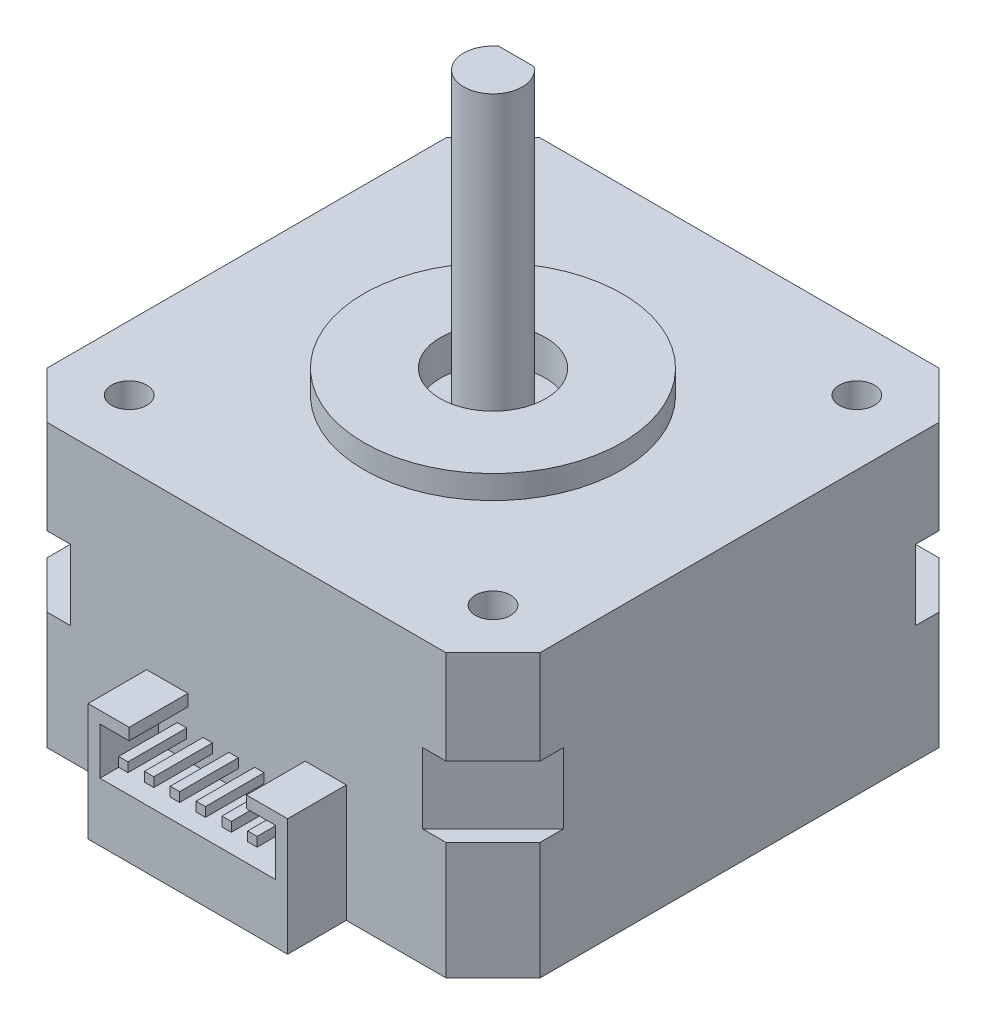
from build123d import *

# Parameters (mm, degrees)
EXTRUDE_1_DEPTH     = 10
EXTRUDE_2_DEPTH     = 6
EXTRUDE_3_DEPTH     = 8
SKETCH_5_R          = 11
EXTRUDE_4_DEPTH     = 2
SKETCH_6_R          = 4.5
CUT_EXTRUDE_1_DEPTH = 3
SKETCH_7_R          = 2.5
EXTRUDE_5_DEPTH     = 25
CUT_EXTRUDE_START   = -22
CUT_EXTRUDE_2_DEPTH = 22
SKETCH_9_R          = 1.5
CUT_EXTRUDE_3_DEPTH = 10
SKETCH_10_W         = 17
SKETCH_10_H         = 10
EXTRUDE_6_DEPTH     = 5
SKETCH_11_W         = 14.973580244
SKETCH_11_H         = 4
CUT_EXTRUDE_4_DEPTH = 5
SKETCH_12_W         = 10
SKETCH_12_H         = 1.224563607
CUT_EXTRUDE_5_DEPTH = 5
SKETCH_13_W         = 0.8
SKETCH_13_H         = 0.8
EXTRUDE_7_DEPTH     = 5


with BuildPart() as part:
    # 草图1 → 凸台-拉伸1 (new body)
    with BuildSketch(Plane(origin=(0, 0, 0), x_dir=(1, 0, 0), z_dir=(0, 1, 0))):
        Polygon((-17, -21), (17, -21), (21, -17), (21, 17), (17, 21), (-17, 21), (-21, 17), (-21, -17), align=None)
    extrude(amount=EXTRUDE_1_DEPTH)

    # 草图3 → 凸台-拉伸2 (add)
    with BuildSketch(Plane(origin=(0, 10, 0), x_dir=(1, 0, 0), z_dir=(0, 1, 0))):
        Polygon((15, 21), (21, 15), (21, -15), (15, -21), (-15, -21), (-21, -15), (-21, 15), (-15, 21), align=None)
    extrude(amount=EXTRUDE_2_DEPTH)

    # 草图4 → 凸台-拉伸3 (add)
    with BuildSketch(Plane(origin=(0, 16, 0), x_dir=(1, 0, 0), z_dir=(0, 1, 0))):
        Polygon((15, 21), (-15, 21), (-17, 21), (-21, 17), (-21, 15), (-21, -15), (-21, -17), (-17, -21), (-15, -21), (15, -21), (17, -21), (21, -17), (21, -15), (21, 15), (21, 17), (17, 21), align=None)
    extrude(amount=EXTRUDE_3_DEPTH)

    # 草图5 → 凸台-拉伸4 (add)
    with BuildSketch(Plane(origin=(0, 24, 0), x_dir=(1, 0, 0), z_dir=(0, 1, 0))):
        with Locations(Location((0, 0, 0), (0, 0, 270))):
            Circle(SKETCH_5_R)
    extrude(amount=EXTRUDE_4_DEPTH)

    # 草图6 → 切除-拉伸1 (cut)
    with BuildSketch(Plane(origin=(0, 26, 0), x_dir=(1, 0, 0), z_dir=(0, 1, 0))):
        with Locations(Location((0, 0, 0), (0, 0, 270))):
            Circle(SKETCH_6_R)
    extrude(amount=-CUT_EXTRUDE_1_DEPTH, mode=Mode.SUBTRACT)

    # 草图7 → 凸台-拉伸5 (add)
    with BuildSketch(Plane(origin=(0, 23, 0), x_dir=(1, 0, 0), z_dir=(0, 1, 0))):
        with Locations(Location((0, 0, 0), (0, 0, 270))):
            Circle(SKETCH_7_R)
    extrude(amount=EXTRUDE_5_DEPTH)

    # 草图8 → 切除-拉伸2 (cut)
    with BuildSketch(Plane(origin=(0, 48, 0), x_dir=(1, 0, 0), z_dir=(0, 1, 0)).offset(CUT_EXTRUDE_START)):
        with BuildLine():
            Line((-1.5, 2), (1.5, 2))
            ThreePointArc((1.5, 2), (0, 2.5), (-1.5, 2))
        make_face()
    extrude(amount=CUT_EXTRUDE_2_DEPTH, mode=Mode.SUBTRACT)

    # 草图9 → 切除-拉伸3 (cut)
    with BuildSketch(Plane(origin=(0, 24, 0), x_dir=(1, 0, 0), z_dir=(0, 1, 0))):
        with Locations(Location((-15.5, 15.5, 0), (0, 0, 270))):
            Circle(SKETCH_9_R)
        with Locations(Location((15.5, 15.5, 0), (0, 0, 270))):
            Circle(SKETCH_9_R)
        with Locations(Location((15.5, -15.5, 0), (0, 0, 270))):
            Circle(SKETCH_9_R)
        with Locations(Location((-15.5, -15.5, 0), (0, 0, 270))):
            Circle(SKETCH_9_R)
    extrude(amount=-CUT_EXTRUDE_3_DEPTH, mode=Mode.SUBTRACT)

    # 草图10 → 凸台-拉伸6 (add)
    with BuildSketch(Plane.XY.offset(21)):
        with Locations((0, 5)):
            Rectangle(SKETCH_10_W, SKETCH_10_H)
    extrude(amount=EXTRUDE_6_DEPTH)

    # 草图11 → 切除-拉伸4 (cut)
    with BuildSketch(Plane.XY.offset(26)):
        with Locations((0, 7)):
            Rectangle(SKETCH_11_W, SKETCH_11_H)
    extrude(amount=-CUT_EXTRUDE_4_DEPTH, mode=Mode.SUBTRACT)

    # 草图12 → 切除-拉伸5 (cut)
    with BuildSketch(Plane.XY.offset(26)):
        with Locations((0, 9.612281804)):
            Rectangle(SKETCH_12_W, SKETCH_12_H)
    extrude(amount=-CUT_EXTRUDE_5_DEPTH, mode=Mode.SUBTRACT)

    # 草图13 → 凸台-拉伸7 (add)
    with BuildSketch(Plane.XY.offset(21)):
        with Locations((-5.5, 7)):
            Rectangle(SKETCH_13_W, SKETCH_13_H)
        with Locations((-3.3, 7)):
            Rectangle(SKETCH_13_W, SKETCH_13_H)
        with Locations((-1.1, 7)):
            Rectangle(SKETCH_13_W, SKETCH_13_H)
        with Locations((1.1, 7)):
            Rectangle(SKETCH_13_W, SKETCH_13_H)
        with Locations((3.3, 7)):
            Rectangle(SKETCH_13_W, SKETCH_13_H)
        with Locations((5.5, 7)):
            Rectangle(SKETCH_13_W, SKETCH_13_H)
    extrude(amount=EXTRUDE_7_DEPTH)


solid = part.part
